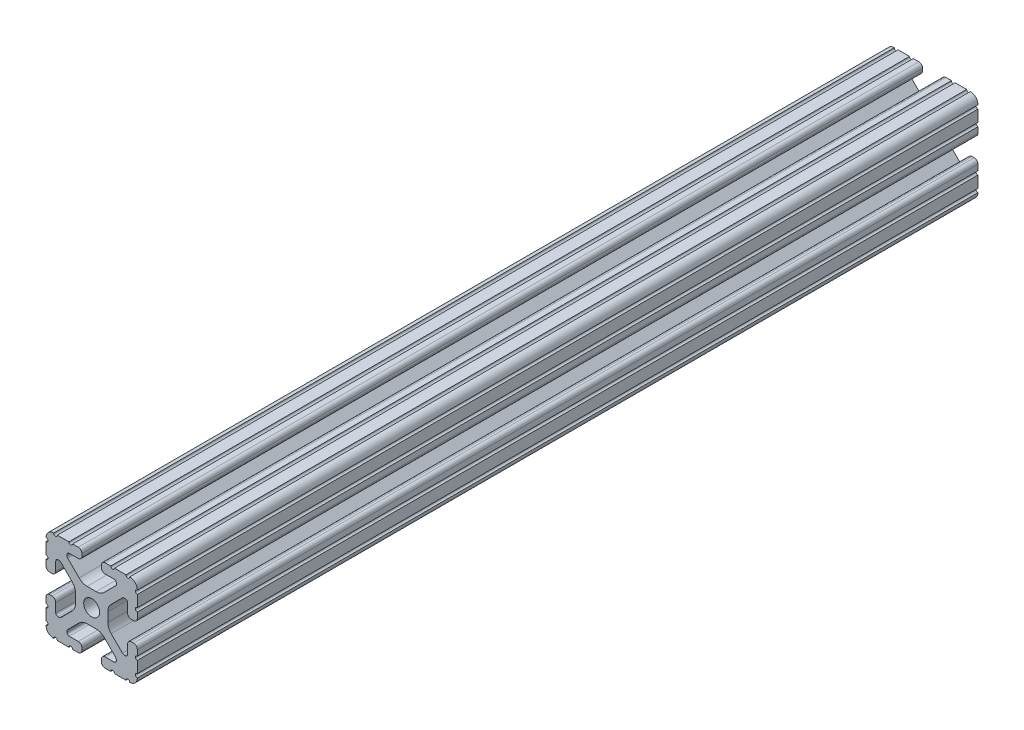
from build123d import *

# Parameters (mm, degrees)
SKETCH1_R      = 3.3274
EXTRUDE1_DEPTH = 350.8


with BuildPart() as part:
    # Sketch1 → Extrude1 (new body)
    with BuildSketch(Plane.XY):
        with BuildLine():
            Line((-10.022898969, 12.91475973), (-5.252158105, 8.144007132))
            ThreePointArc((-5.252158105, 8.144007132), (-3.715177372, 7.117027388), (-1.902183975, 6.7564))
            Line((-1.902183975, 6.7564), (1.902183975, 6.7564))
            ThreePointArc((1.902183975, 6.7564), (3.715177372, 7.117027388), (5.252158105, 8.144007132))
            Line((5.252158105, 8.144007132), (10.022898969, 12.91475973))
            ThreePointArc((10.022898969, 12.91475973), (10.218362387, 13.207291992), (10.287, 13.552357131))
            Line((10.287, 13.552357131), (10.287, 14.0843))
            ThreePointArc((10.287, 14.0843), (10.022898185, 14.721898185), (9.3853, 14.986))
            Line((9.3853, 14.986), (5.617617549, 14.986))
            ThreePointArc((5.617617549, 14.986), (4.519044045, 15.441044045), (4.064, 16.539617549))
            Line((4.064, 16.539617549), (4.064, 17.496382451))
            ThreePointArc((4.064, 17.496382451), (4.519044045, 18.594955955), (5.617617549, 19.05))
            Line((5.617617549, 19.05), (7.974178704, 19.05))
            ThreePointArc((7.974178704, 19.05), (8.736178704, 18.288), (9.498178704, 19.05))
            Line((9.498178704, 19.05), (14.327719207, 19.05))
            ThreePointArc((14.327719207, 19.05), (15.087603123, 18.231251131), (15.847487039, 19.05))
            ThreePointArc((15.847487039, 19.05), (18.120176289, 18.120192083), (19.05, 15.847509295))
            ThreePointArc((19.05, 15.847509295), (18.231250992, 15.08762539), (19.05, 14.327741484))
            Line((19.05, 14.327741484), (19.05, 9.496091471))
            ThreePointArc((19.05, 9.496091471), (18.231250992, 8.736207565), (19.05, 7.97632366))
            Line((19.05, 7.97632366), (19.05, 5.617617549))
            ThreePointArc((19.05, 5.617617549), (18.594955955, 4.519044045), (17.496382451, 4.064))
            Line((17.496382451, 4.064), (16.539617549, 4.064))
            ThreePointArc((16.539617549, 4.064), (15.441044045, 4.519044045), (14.986, 5.617617549))
            Line((14.986, 5.617617549), (14.986, 9.385342516))
            ThreePointArc((14.986, 9.385342516), (14.721898185, 10.022940701), (14.0843, 10.287042516))
            Line((14.0843, 10.287042516), (13.516042086, 10.287042516))
            ThreePointArc((13.516042086, 10.287042516), (13.170975923, 10.218404478), (12.878443117, 10.022939917))
            Line((12.878443117, 10.022939917), (8.14758008, 5.292065243))
            ThreePointArc((8.14758008, 5.292065243), (7.117955879, 3.751120653), (6.7564, 1.933453584))
            Line((6.7564, 1.933453584), (6.7564, -1.933453584))
            ThreePointArc((6.7564, -1.933453584), (7.117955879, -3.751120653), (8.14758008, -5.292065243))
            Line((8.14758008, -5.292065243), (12.878443117, -10.022939917))
            ThreePointArc((12.878443117, -10.022939917), (13.170975923, -10.218404478), (13.516042086, -10.287042516))
            Line((13.516042086, -10.287042516), (14.0843, -10.287042516))
            ThreePointArc((14.0843, -10.287042516), (14.721898185, -10.022940701), (14.986, -9.385342516))
            Line((14.986, -9.385342516), (14.986, -5.617617549))
            ThreePointArc((14.986, -5.617617549), (15.441044045, -4.519044045), (16.539617549, -4.064))
            Line((16.539617549, -4.064), (17.496382451, -4.064))
            ThreePointArc((17.496382451, -4.064), (18.594955955, -4.519044045), (19.05, -5.617617549))
            Line((19.05, -5.617617549), (19.05, -7.976318491))
            ThreePointArc((19.05, -7.976318491), (18.231250992, -8.736202396), (19.05, -9.496086302))
            Line((19.05, -9.496086302), (19.05, -14.32774291))
            ThreePointArc((19.05, -14.32774291), (18.231250992, -15.087626816), (19.05, -15.847510721))
            ThreePointArc((19.05, -15.847510721), (18.120175716, -18.120192644), (15.847486868, -19.05))
            ThreePointArc((15.847486868, -19.05), (15.087602952, -18.231251131), (14.327719036, -19.05))
            Line((14.327719036, -19.05), (9.496062448, -19.05))
            ThreePointArc((9.496062448, -19.05), (8.736178532, -18.231251131), (7.976294616, -19.05))
            Line((7.976294616, -19.05), (5.617617549, -19.05))
            ThreePointArc((5.617617549, -19.05), (4.519044045, -18.594955955), (4.064, -17.496382451))
            Line((4.064, -17.496382451), (4.064, -16.539617549))
            ThreePointArc((4.064, -16.539617549), (4.519044045, -15.441044045), (5.617617549, -14.986))
            Line((5.617617549, -14.986), (9.3853, -14.986))
            ThreePointArc((9.3853, -14.986), (10.022898185, -14.721898185), (10.287, -14.0843))
            Line((10.287, -14.0843), (10.287, -13.552357131))
            ThreePointArc((10.287, -13.552357131), (10.218362387, -13.207291992), (10.022898969, -12.91475973))
            Line((10.022898969, -12.91475973), (5.252158105, -8.144007132))
            ThreePointArc((5.252158105, -8.144007132), (3.715177372, -7.117027388), (1.902183975, -6.7564))
            Line((1.902183975, -6.7564), (-1.902183975, -6.7564))
            ThreePointArc((-1.902183975, -6.7564), (-3.715177372, -7.117027388), (-5.252158105, -8.144007132))
            Line((-5.252158105, -8.144007132), (-10.022898969, -12.91475973))
            ThreePointArc((-10.022898969, -12.91475973), (-10.218362387, -13.207291992), (-10.287, -13.552357131))
            Line((-10.287, -13.552357131), (-10.287, -14.0843))
            ThreePointArc((-10.287, -14.0843), (-10.022898185, -14.721898185), (-9.3853, -14.986))
            Line((-9.3853, -14.986), (-5.617617549, -14.986))
            ThreePointArc((-5.617617549, -14.986), (-4.519044045, -15.441044045), (-4.064, -16.539617549))
            Line((-4.064, -16.539617549), (-4.064, -17.496382451))
            ThreePointArc((-4.064, -17.496382451), (-4.519044045, -18.594955955), (-5.617617549, -19.05))
            Line((-5.617617549, -19.05), (-7.976294616, -19.05))
            ThreePointArc((-7.976294616, -19.05), (-8.736178532, -18.231251131), (-9.496062448, -19.05))
            Line((-9.496062448, -19.05), (-14.327719036, -19.05))
            ThreePointArc((-14.327719036, -19.05), (-15.087602952, -18.231251131), (-15.847486868, -19.05))
            ThreePointArc((-15.847486868, -19.05), (-18.120175716, -18.120192644), (-19.05, -15.847510721))
            ThreePointArc((-19.05, -15.847510721), (-18.231250992, -15.087626816), (-19.05, -14.32774291))
            Line((-19.05, -14.32774291), (-19.05, -9.496086302))
            ThreePointArc((-19.05, -9.496086302), (-18.231250992, -8.736202396), (-19.05, -7.976318491))
            Line((-19.05, -7.976318491), (-19.05, -5.617617549))
            ThreePointArc((-19.05, -5.617617549), (-18.594955955, -4.519044045), (-17.496382451, -4.064))
            Line((-17.496382451, -4.064), (-16.539617549, -4.064))
            ThreePointArc((-16.539617549, -4.064), (-15.441044045, -4.519044045), (-14.986, -5.617617549))
            Line((-14.986, -5.617617549), (-14.986, -9.385342516))
            ThreePointArc((-14.986, -9.385342516), (-14.721898185, -10.022940701), (-14.0843, -10.287042516))
            Line((-14.0843, -10.287042516), (-13.516042086, -10.287042516))
            ThreePointArc((-13.516042086, -10.287042516), (-13.170975923, -10.218404478), (-12.878443117, -10.022939917))
            Line((-12.878443117, -10.022939917), (-8.14758008, -5.292065243))
            ThreePointArc((-8.14758008, -5.292065243), (-7.117955879, -3.751120653), (-6.7564, -1.933453584))
            Line((-6.7564, -1.933453584), (-6.7564, 1.933453584))
            ThreePointArc((-6.7564, 1.933453584), (-7.117955879, 3.751120653), (-8.14758008, 5.292065243))
            Line((-8.14758008, 5.292065243), (-12.878443117, 10.022939917))
            ThreePointArc((-12.878443117, 10.022939917), (-13.170975923, 10.218404478), (-13.516042086, 10.287042516))
            Line((-13.516042086, 10.287042516), (-14.0843, 10.287042516))
            ThreePointArc((-14.0843, 10.287042516), (-14.721898185, 10.022940701), (-14.986, 9.385342516))
            Line((-14.986, 9.385342516), (-14.986, 5.617617549))
            ThreePointArc((-14.986, 5.617617549), (-15.441044045, 4.519044045), (-16.539617549, 4.064))
            Line((-16.539617549, 4.064), (-17.496382451, 4.064))
            ThreePointArc((-17.496382451, 4.064), (-18.594955955, 4.519044045), (-19.05, 5.617617549))
            Line((-19.05, 5.617617549), (-19.05, 7.97632366))
            ThreePointArc((-19.05, 7.97632366), (-18.231250992, 8.736207565), (-19.05, 9.496091471))
            Line((-19.05, 9.496091471), (-19.05, 14.327741484))
            ThreePointArc((-19.05, 14.327741484), (-18.231250992, 15.08762539), (-19.05, 15.847509295))
            ThreePointArc((-19.05, 15.847509295), (-18.120176289, 18.120192083), (-15.847487039, 19.05))
            ThreePointArc((-15.847487039, 19.05), (-15.087603123, 18.231251131), (-14.327719207, 19.05))
            Line((-14.327719207, 19.05), (-9.498178704, 19.05))
            ThreePointArc((-9.498178704, 19.05), (-8.736178704, 18.288), (-7.974178704, 19.05))
            Line((-7.974178704, 19.05), (-5.617617549, 19.05))
            ThreePointArc((-5.617617549, 19.05), (-4.519044045, 18.594955955), (-4.064, 17.496382451))
            Line((-4.064, 17.496382451), (-4.064, 16.539617549))
            ThreePointArc((-4.064, 16.539617549), (-4.519044045, 15.441044045), (-5.617617549, 14.986))
            Line((-5.617617549, 14.986), (-9.3853, 14.986))
            ThreePointArc((-9.3853, 14.986), (-10.022898185, 14.721898185), (-10.287, 14.0843))
            Line((-10.287, 14.0843), (-10.287, 13.552357131))
            ThreePointArc((-10.287, 13.552357131), (-10.218362387, 13.207291992), (-10.022898969, 12.91475973))
        make_face()
        Circle(SKETCH1_R, mode=Mode.SUBTRACT)
    extrude(amount=-EXTRUDE1_DEPTH)


solid = part.part
